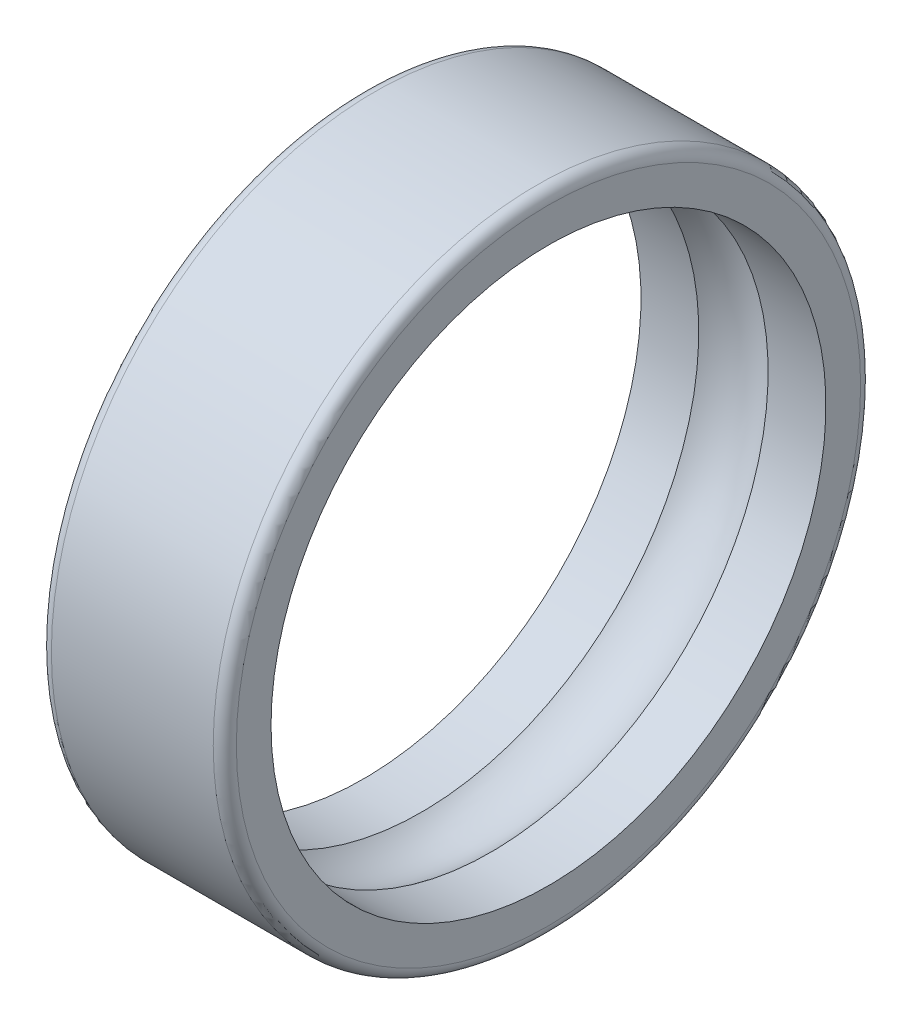
from build123d import *


with BuildPart() as part:
    # Esquisse1 → Bague exterieure (revolve)
    with BuildSketch(Plane.XY, mode=Mode.PRIVATE) as bague_exterieure_sk:
        with BuildLine():
            Line((0, 12), (0, 13.5))
            ThreePointArc((0, 13.5), (0.146446609, 13.853553391), (0.5, 14))
            Line((0.5, 14), (7.5, 14))
            ThreePointArc((7.5, 14), (7.853553391, 13.853553391), (8, 13.5))
            Line((8, 13.5), (8, 12))
            Line((8, 12), (5.5, 12))
            ThreePointArc((5.5, 12), (4, 12.5), (2.5, 12))
            Line((2.5, 12), (0, 12))
        make_face()
    revolve(bague_exterieure_sk.sketch.rotate(Axis((0, 0, 0), (1, 0, 0)), 90), axis=Axis((0, 0, 0), (1, 0, 0)))


solid = part.part
